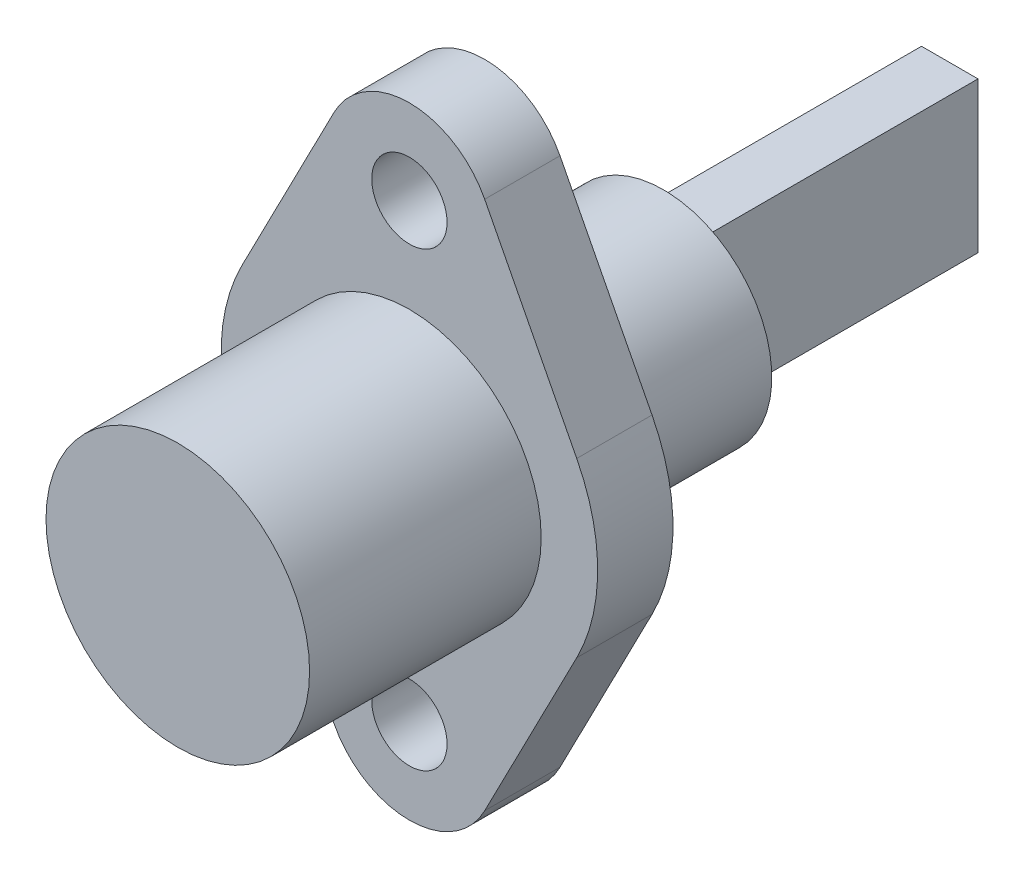
from build123d import *

# Parameters (mm, degrees)
SKETCH1_R           = 2
BOSS_EXTRUDE1_DEPTH = 4
SKETCH2_R           = 7
BOSS_EXTRUDE2_DEPTH = 12.3
SKETCH3_R           = 7.5
BOSS_EXTRUDE3_DEPTH = 0.5
SKETCH4_W           = 3
SKETCH4_H           = 8
BOSS_EXTRUDE4_DEPTH = 24.2
SKETCH5_R           = 5.75
BOSS_EXTRUDE5_DEPTH = 9


with BuildPart() as part:
    # Sketch1 → Boss-Extrude1 (new body)
    with BuildSketch(Plane.XY):
        with BuildLine():
            ThreePointArc((-3.999511648, -14.062500079), (-8.7e-08, -16.5), (3.999511568, -14.062500234))
            Line((3.999511568, -14.062500234), (8.887803753, -4.583333333))
            ThreePointArc((8.887803753, -4.583333333), (10, 0), (8.887803753, 4.583333333))
            Line((8.887803753, 4.583333333), (3.999511579, 14.062500214))
            ThreePointArc((3.999511579, 14.062500214), (-6.7e-08, 16.5), (-3.99951164, 14.062500095))
            Line((-3.99951164, 14.062500095), (-8.887803753, 4.583333333))
            ThreePointArc((-8.887803753, 4.583333333), (-10, 0), (-8.887803753, -4.583333333))
            Line((-8.887803753, -4.583333333), (-3.999511648, -14.062500079))
        make_face()
        with Locations((0, -12)):
            Circle(SKETCH1_R, mode=Mode.SUBTRACT)
        with Locations((0, 12)):
            Circle(SKETCH1_R, mode=Mode.SUBTRACT)
    extrude(amount=BOSS_EXTRUDE1_DEPTH)

    # Sketch2 → Boss-Extrude2 (add)
    with BuildSketch(Plane.XY.offset(4)):
        Circle(SKETCH2_R)
    extrude(amount=BOSS_EXTRUDE2_DEPTH)

    # Sketch3 → Boss-Extrude3 (add)
    with BuildSketch(Plane(origin=(0, 0, 0), x_dir=(-1, 0, 0), z_dir=(0, 0, -1))):
        with Locations(Location((0, 0, 0), (0, 0, 180))):
            Circle(SKETCH3_R)
    extrude(amount=BOSS_EXTRUDE3_DEPTH)

    # Sketch4 → Boss-Extrude4 (add)
    with BuildSketch(Plane(origin=(0, 0, -0.5), x_dir=(-1, 0, 0), z_dir=(0, 0, -1))):
        Rectangle(SKETCH4_W, SKETCH4_H)
    extrude(amount=BOSS_EXTRUDE4_DEPTH)

    # Sketch5 → Boss-Extrude5 (add)
    with BuildSketch(Plane(origin=(0, 0, -0.5), x_dir=(-1, 0, 0), z_dir=(0, 0, -1))):
        Circle(SKETCH5_R)
    extrude(amount=BOSS_EXTRUDE5_DEPTH)


solid = part.part
